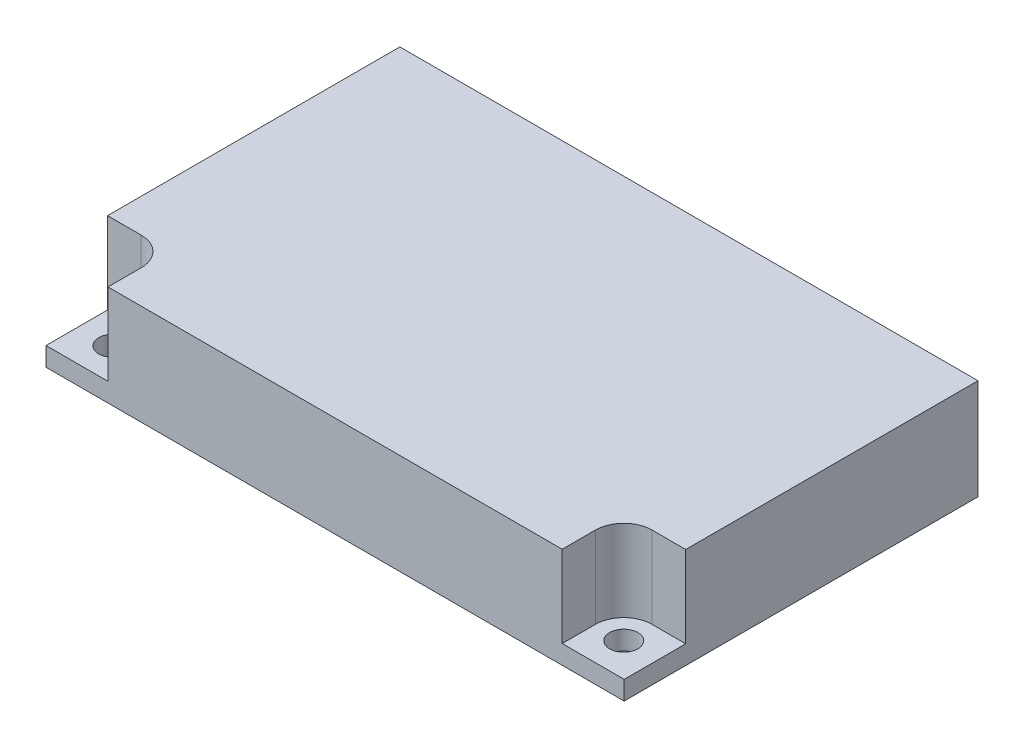
from build123d import *

# Parameters (mm, degrees)
SKETCH1_W           = 46
SKETCH1_H           = 28.15
SKETCH1_R           = 1.125
BOSS_EXTRUDE1_DEPTH = 1.5
BOSS_EXTRUDE2_DEPTH = 6.5


with BuildPart() as part:
    # Sketch1 → Boss-Extrude1 (new body)
    with BuildSketch(Plane(origin=(0, 0, 0), x_dir=(1, 0, 0), z_dir=(0, 1, 0))):
        Rectangle(SKETCH1_W, SKETCH1_H)
        with Locations(Location((20.32, -11.43, 0), (0, 0, 270))):
            Circle(SKETCH1_R, mode=Mode.SUBTRACT)
        with Locations(Location((-20.32, -11.43, 0), (0, 0, 90))):
            Circle(SKETCH1_R, mode=Mode.SUBTRACT)
    extrude(amount=BOSS_EXTRUDE1_DEPTH)

    # Sketch2 → Boss-Extrude2 (add)
    with BuildSketch(Plane(origin=(0, 1.5, 0), x_dir=(1, 0, 0), z_dir=(0, 1, 0))):
        with BuildLine():
            Line((-18.07, -11.43), (-18.07, -14.075))
            Line((-18.07, -14.075), (18.07, -14.075))
            Line((18.07, -14.075), (18.07, -11.43))
            ThreePointArc((18.07, -11.43), (18.729009742, -9.839009742), (20.32, -9.18))
            Line((20.32, -9.18), (23, -9.18))
            Line((23, -9.18), (23, 14.075))
            Line((23, 14.075), (-23, 14.075))
            Line((-23, 14.075), (-23, -9.18))
            Line((-23, -9.18), (-20.32, -9.18))
            ThreePointArc((-20.32, -9.18), (-18.729009742, -9.839009742), (-18.07, -11.43))
        make_face()
    extrude(amount=BOSS_EXTRUDE2_DEPTH)


solid = part.part
